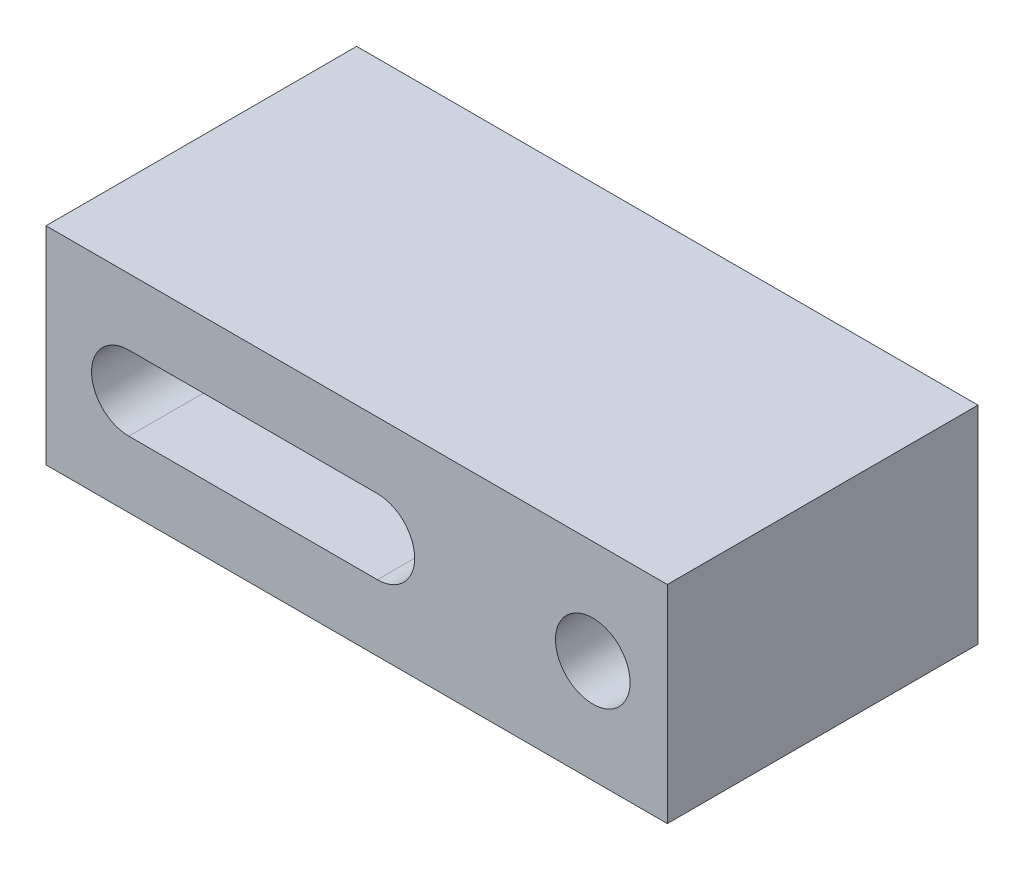
from build123d import *

# Parameters (mm, degrees)
SKETCH1_W           = 1500
SKETCH1_H           = 750
BOSS_EXTRUDE1_DEPTH = 500
SKETCH2_R           = 90
CUT_EXTRUDE1_DEPTH  = 1173.603939956


with BuildPart() as part:
    # Sketch1 → Boss-Extrude1 (new body)
    with BuildSketch(Plane(origin=(0, 0, 0), x_dir=(1, 0, 0), z_dir=(0, 1, 0))):
        Rectangle(SKETCH1_W, SKETCH1_H)
    extrude(amount=BOSS_EXTRUDE1_DEPTH)

    # Sketch2 → Cut-Extrude1 (cut, through all)
    with BuildSketch(Plane.XY.offset(375)):
        with Locations((570, 250)):
            Circle(SKETCH2_R)
        with BuildLine():
            Line((-550, 340), (50, 340))
            ThreePointArc((50, 340), (140, 250), (50, 160))
            Line((50, 160), (-550, 160))
            ThreePointArc((-550, 160), (-640, 250), (-550, 340))
        make_face()
    extrude(amount=-CUT_EXTRUDE1_DEPTH, mode=Mode.SUBTRACT)


solid = part.part
